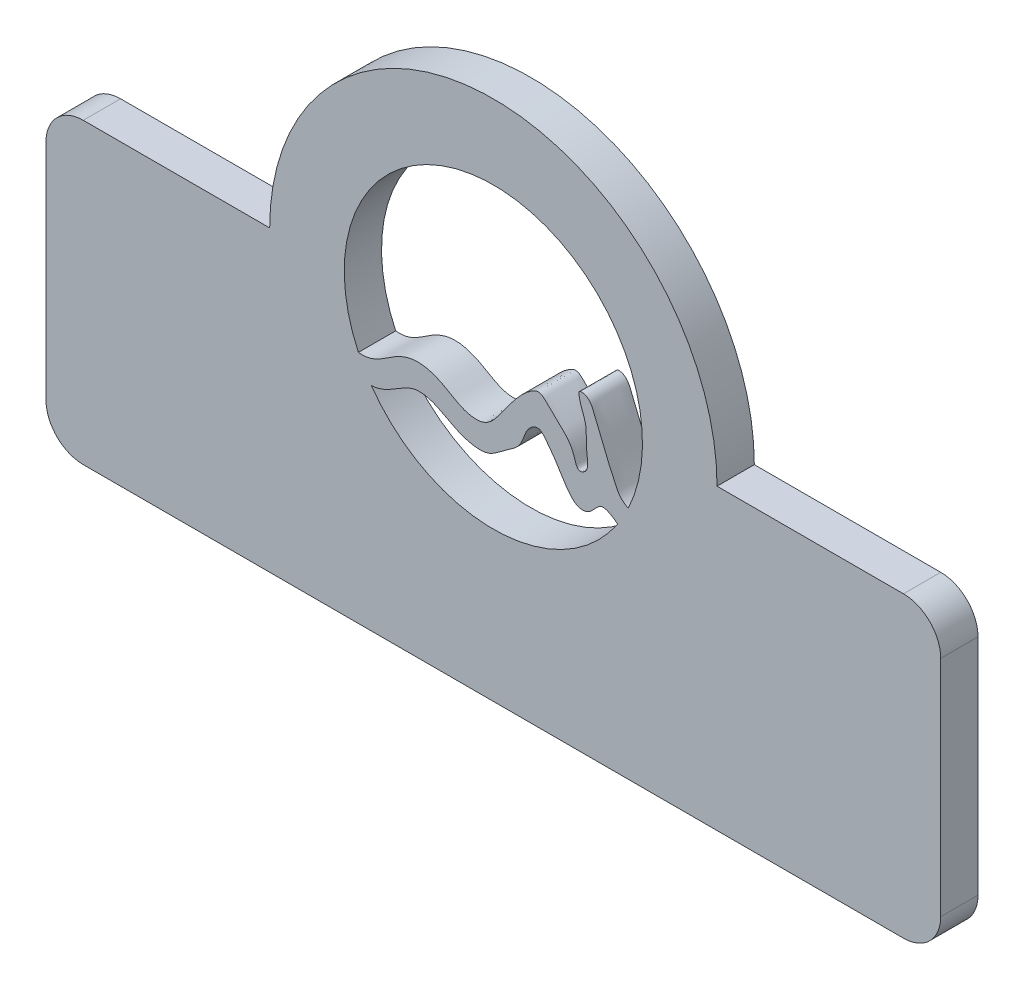
from build123d import *

# Parameters (mm, degrees)
BOSS_EXTRUDE3_DEPTH = 3.175
CUT_EXTRUDE2_START  = 3.175
CUT_EXTRUDE2_DEPTH  = 3.175
FILLET1_R           = 3.175


with BuildPart() as part:
    # Sketch1 → Boss-Extrude3 (new body)
    with BuildSketch(Plane.XY):
        with BuildLine():
            Line((35.78531497, 16.139458277), (54.83531497, 16.139458277))
            Line((54.83531497, 16.139458277), (54.83531497, -9.260541723))
            Line((54.83531497, -9.260541723), (-21.36468503, -9.260541723))
            Line((-21.36468503, -9.260541723), (-21.36468503, 16.139458277))
            Line((-21.36468503, 16.139458277), (-2.31468503, 16.139458277))
            ThreePointArc((-2.31468503, 16.139458277), (16.73531497, 35.189458277), (35.78531497, 16.139458277))
        make_face()
    extrude(amount=BOSS_EXTRUDE3_DEPTH)

    # Sketch2 → Cut-Extrude2 (cut)
    with BuildSketch(Plane.XY.offset(CUT_EXTRUDE2_START)):
        with BuildLine():
            ThreePointArc((26.686575031, 24.030112445), (12.557456834, 28.13260221), (4.03531497, 16.139458279))
            ThreePointArc((4.03531497, 16.139458279), (4.34070144, 13.37114553), (5.242174099, 10.735967468))
            add(Edge.make_bspline(
                [(5.242174099, 10.735967468), (6.71809569, 10.558336312), (7.918117514, 12.03347609), (10.468854722, 12.765944744), (12.442903728, 12.098140871), (13.961959658, 10.988070936), (15.124564972, 10.779857682), (15.530263626, 10.828286766)],
                knots=[0, 0, 0, 0, 0.103449195, 0.139241601, 0.205578262, 0.258601603, 0.291638302, 0.291638302, 0.291638302, 0.291638302], degree=3))
            add(Edge.make_bspline(
                [(15.530263626, 10.828286766), (14.893940081, 12.095087951), (14.438868342, 13.981262833), (14.343537675, 16.73425729), (15.269082011, 18.244723048), (16.506241707, 19.50741569), (18.140034136, 19.466216754), (19.332002745, 18.736180633), (19.902448165, 17.965467921), (20.681743122, 17.471570607), (21.448331705, 18.509031687), (21.733369869, 19.503537614), (22.291305084, 20.939072019), (23.514109208, 20.496889567), (23.332972834, 19.735543014), (23.678738278, 18.951349284), (24.892829136, 19.856633997), (24.704069783, 21.798562579), (25.937040799, 23.315779233), (26.686575031, 24.030112445)],
                knots=[0, 0, 0, 0, 0.163826768, 0.228294741, 0.314759461, 0.363733255, 0.427293954, 0.487534152, 0.520272147, 0.543412507, 0.580045633, 0.637017643, 0.689480468, 0.715613554, 0.754599818, 0.768000956, 0.802503201, 0.870835866, 1, 1, 1, 1], degree=3))
        make_face()
        with BuildLine():
            ThreePointArc((28.22845584, 10.735967468), (29.129928498, 13.371145529), (29.43531497, 16.139458277))
            ThreePointArc((29.43531497, 16.139458277), (28.728458902, 20.317316414), (26.686575031, 24.030112445))
            add(Edge.make_bspline(
                [(15.530263626, 10.828286766), (14.893940081, 12.095087951), (14.438868342, 13.981262833), (14.343537675, 16.73425729), (15.269082011, 18.244723048), (16.506241707, 19.50741569), (18.140034136, 19.466216754), (19.332002745, 18.736180633), (19.902448165, 17.965467921), (20.681743122, 17.471570607), (21.448331705, 18.509031687), (21.733369869, 19.503537614), (22.291305084, 20.939072019), (23.514109208, 20.496889567), (23.332972834, 19.735543014), (23.678738278, 18.951349284), (24.892829136, 19.856633997), (24.704069783, 21.798562579), (25.937040799, 23.315779233), (26.686575031, 24.030112445)],
                knots=[0, 0, 0, 0, 0.163826768, 0.228294741, 0.314759461, 0.363733255, 0.427293954, 0.487534152, 0.520272147, 0.543412507, 0.580045633, 0.637017643, 0.689480468, 0.715613554, 0.754599818, 0.768000956, 0.802503201, 0.870835866, 1, 1, 1, 1], degree=3))
            add(Edge.make_bspline(
                [(15.530263626, 10.828286766), (15.626387534, 10.839761274), (16.489777481, 11.011623424), (17.499150898, 12.517877657), (18.687719037, 14.101458352), (19.657939915, 15.107245777), (20.736594209, 15.671140337), (21.592414385, 14.657430773), (22.718560515, 13.747508546), (23.569829513, 12.703280038), (23.862593949, 11.274580766), (24.95336238, 11.697819528), (24.5406586, 13.349786862), (24.808258039, 15.139757069), (24.095016856, 16.301161897), (23.99892435, 17.331566416), (24.934028737, 17.313329169), (25.368213122, 16.039497011), (25.991460724, 14.726460411), (26.406764207, 13.484600275), (27.128521052, 12.146063772), (27.369998366, 11.103966692), (28.22845584, 10.735967468)],
                knots=[0.291638302, 0.291638302, 0.291638302, 0.291638302, 0.299465828, 0.363653171, 0.418235104, 0.461509401, 0.476757706, 0.506042886, 0.54840923, 0.597041835, 0.622241463, 0.63200319, 0.675047866, 0.726967039, 0.779124266, 0.786558575, 0.795901318, 0.835776716, 0.878715553, 0.917236667, 0.938498416, 1, 1, 1, 1], degree=3))
        make_face()
        with BuildLine():
            add(Edge.make_bspline(
                [(6.341335519, 8.841842832), (7.352948834, 8.892765558), (8.439747543, 9.720370574), (10.078322822, 10.548282172), (11.601579158, 10.336773716), (13.010418282, 9.479262177), (14.602994521, 8.760069852), (16.353851818, 8.627242763), (17.638059992, 9.776964582), (19.252211745, 10.645536154), (19.40833239, 12.251159057), (20.601947199, 13.020559931), (21.506732859, 11.937828164), (22.289818404, 10.79448645), (23.033017647, 9.455226836), (23.985183437, 8.541384721), (25.178521672, 8.783631752), (25.858053706, 10.236382277), (27.020441322, 9.326768086), (27.324222726, 9.127680149)],
                knots=[0, 0, 0, 0, 0.111111506, 0.158804473, 0.207674807, 0.281442738, 0.349358567, 0.412439169, 0.469148104, 0.544608443, 0.609896851, 0.643348875, 0.677969984, 0.748784791, 0.815450656, 0.856726934, 0.888904639, 0.942631222, 1, 1, 1, 1], degree=3))
            ThreePointArc((6.341335519, 8.841842832), (16.90830342, 3.440636481), (27.324222726, 9.127680149))
        make_face()
        with BuildLine():
            ThreePointArc((26.686575031, 24.030112445), (12.557456834, 28.13260221), (4.03531497, 16.139458279))
            ThreePointArc((4.03531497, 16.139458279), (4.34070144, 13.37114553), (5.242174099, 10.735967468))
            add(Edge.make_bspline(
                [(5.242174099, 10.735967468), (6.71809569, 10.558336312), (7.918117514, 12.03347609), (10.468854722, 12.765944744), (12.442903728, 12.098140871), (13.961959658, 10.988070936), (15.124564972, 10.779857682), (15.530263626, 10.828286766)],
                knots=[0, 0, 0, 0, 0.103449195, 0.139241601, 0.205578262, 0.258601603, 0.291638302, 0.291638302, 0.291638302, 0.291638302], degree=3))
            add(Edge.make_bspline(
                [(15.530263626, 10.828286766), (14.893940081, 12.095087951), (14.438868342, 13.981262833), (14.343537675, 16.73425729), (15.269082011, 18.244723048), (16.506241707, 19.50741569), (18.140034136, 19.466216754), (19.332002745, 18.736180633), (19.902448165, 17.965467921), (20.681743122, 17.471570607), (21.448331705, 18.509031687), (21.733369869, 19.503537614), (22.291305084, 20.939072019), (23.514109208, 20.496889567), (23.332972834, 19.735543014), (23.678738278, 18.951349284), (24.892829136, 19.856633997), (24.704069783, 21.798562579), (25.937040799, 23.315779233), (26.686575031, 24.030112445)],
                knots=[0, 0, 0, 0, 0.163826768, 0.228294741, 0.314759461, 0.363733255, 0.427293954, 0.487534152, 0.520272147, 0.543412507, 0.580045633, 0.637017643, 0.689480468, 0.715613554, 0.754599818, 0.768000956, 0.802503201, 0.870835866, 1, 1, 1, 1], degree=3))
        make_face()
        with BuildLine():
            ThreePointArc((28.22845584, 10.735967468), (29.129928498, 13.371145529), (29.43531497, 16.139458277))
            ThreePointArc((29.43531497, 16.139458277), (28.728458902, 20.317316414), (26.686575031, 24.030112445))
            add(Edge.make_bspline(
                [(15.530263626, 10.828286766), (14.893940081, 12.095087951), (14.438868342, 13.981262833), (14.343537675, 16.73425729), (15.269082011, 18.244723048), (16.506241707, 19.50741569), (18.140034136, 19.466216754), (19.332002745, 18.736180633), (19.902448165, 17.965467921), (20.681743122, 17.471570607), (21.448331705, 18.509031687), (21.733369869, 19.503537614), (22.291305084, 20.939072019), (23.514109208, 20.496889567), (23.332972834, 19.735543014), (23.678738278, 18.951349284), (24.892829136, 19.856633997), (24.704069783, 21.798562579), (25.937040799, 23.315779233), (26.686575031, 24.030112445)],
                knots=[0, 0, 0, 0, 0.163826768, 0.228294741, 0.314759461, 0.363733255, 0.427293954, 0.487534152, 0.520272147, 0.543412507, 0.580045633, 0.637017643, 0.689480468, 0.715613554, 0.754599818, 0.768000956, 0.802503201, 0.870835866, 1, 1, 1, 1], degree=3))
            add(Edge.make_bspline(
                [(15.530263626, 10.828286766), (15.626387534, 10.839761274), (16.489777481, 11.011623424), (17.499150898, 12.517877657), (18.687719037, 14.101458352), (19.657939915, 15.107245777), (20.736594209, 15.671140337), (21.592414385, 14.657430773), (22.718560515, 13.747508546), (23.569829513, 12.703280038), (23.862593949, 11.274580766), (24.95336238, 11.697819528), (24.5406586, 13.349786862), (24.808258039, 15.139757069), (24.095016856, 16.301161897), (23.99892435, 17.331566416), (24.934028737, 17.313329169), (25.368213122, 16.039497011), (25.991460724, 14.726460411), (26.406764207, 13.484600275), (27.128521052, 12.146063772), (27.369998366, 11.103966692), (28.22845584, 10.735967468)],
                knots=[0.291638302, 0.291638302, 0.291638302, 0.291638302, 0.299465828, 0.363653171, 0.418235104, 0.461509401, 0.476757706, 0.506042886, 0.54840923, 0.597041835, 0.622241463, 0.63200319, 0.675047866, 0.726967039, 0.779124266, 0.786558575, 0.795901318, 0.835776716, 0.878715553, 0.917236667, 0.938498416, 1, 1, 1, 1], degree=3))
        make_face()
    extrude(amount=-CUT_EXTRUDE2_DEPTH, mode=Mode.SUBTRACT)

    # Fillet1
    fillet1_edges = [part.edges().sort_by_distance(p)[0] for p in [
        (54.83531497, 16.139458277, 1.5875),
        (54.83531497, -9.260541723, 1.5875),
        (-21.36468503, -9.260541723, 1.5875),
        (-21.36468503, 16.139458277, 1.5875),
    ]]
    fillet(fillet1_edges, radius=FILLET1_R)


solid = part.part
